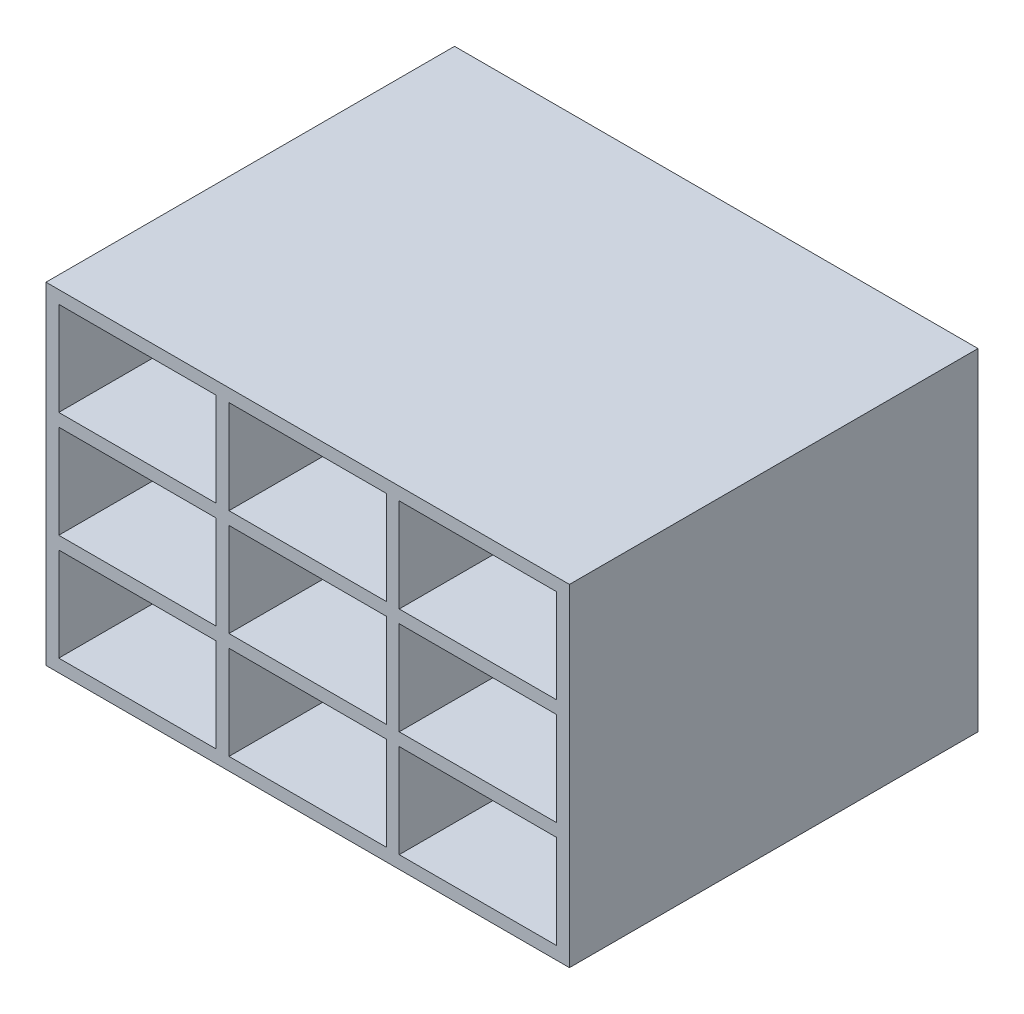
from build123d import *

# Parameters (mm, degrees)
CROQUIS1_W              = 410
CROQUIS1_H              = 260
CROQUIS1_W_2            = 123.333333333
CROQUIS1_H_2            = 73.333333333
CROQUIS1_W_3            = 123.333333334
CROQUIS1_H_3            = 73.333333334
SALIENTE_EXTRUIR3_DEPTH = 300
CROQUIS4_W              = 410
CROQUIS4_H              = 260
SALIENTE_EXTRUIR4_DEPTH = 20


with BuildPart() as part:
    # Croquis1 → Saliente-Extruir3 (new body)
    with BuildSketch(Plane.XY):
        with Locations((200, 125)):
            Rectangle(CROQUIS1_W, CROQUIS1_H)
        with Locations((66.666666667, 41.666666666)):
            Rectangle(CROQUIS1_W_2, CROQUIS1_H_2, mode=Mode.SUBTRACT)
        with Locations((200, 41.666666666)):
            Rectangle(CROQUIS1_W_3, CROQUIS1_H_2, mode=Mode.SUBTRACT)
        with Locations((333.333333334, 125)):
            Rectangle(CROQUIS1_W_2, CROQUIS1_H_3, mode=Mode.SUBTRACT)
        with Locations((333.333333334, 41.666666666)):
            Rectangle(CROQUIS1_W_2, CROQUIS1_H_2, mode=Mode.SUBTRACT)
        with Locations((66.666666667, 125)):
            Rectangle(CROQUIS1_W_2, CROQUIS1_H_3, mode=Mode.SUBTRACT)
        with Locations((66.666666667, 208.333333334)):
            Rectangle(CROQUIS1_W_2, CROQUIS1_H_2, mode=Mode.SUBTRACT)
        with Locations((200, 125)):
            Rectangle(CROQUIS1_W_3, CROQUIS1_H_3, mode=Mode.SUBTRACT)
        with Locations((200, 208.333333334)):
            Rectangle(CROQUIS1_W_3, CROQUIS1_H_2, mode=Mode.SUBTRACT)
        with Locations((333.333333334, 208.333333334)):
            Rectangle(CROQUIS1_W_2, CROQUIS1_H_2, mode=Mode.SUBTRACT)
    extrude(amount=-SALIENTE_EXTRUIR3_DEPTH)

    # Croquis4 → Saliente-Extruir4 (add)
    with BuildSketch(Plane(origin=(0, 0, -300), x_dir=(-1, 0, 0), z_dir=(0, 0, -1))):
        with Locations((-200, 125)):
            Rectangle(CROQUIS4_W, CROQUIS4_H)
    extrude(amount=SALIENTE_EXTRUIR4_DEPTH)


solid = part.part
